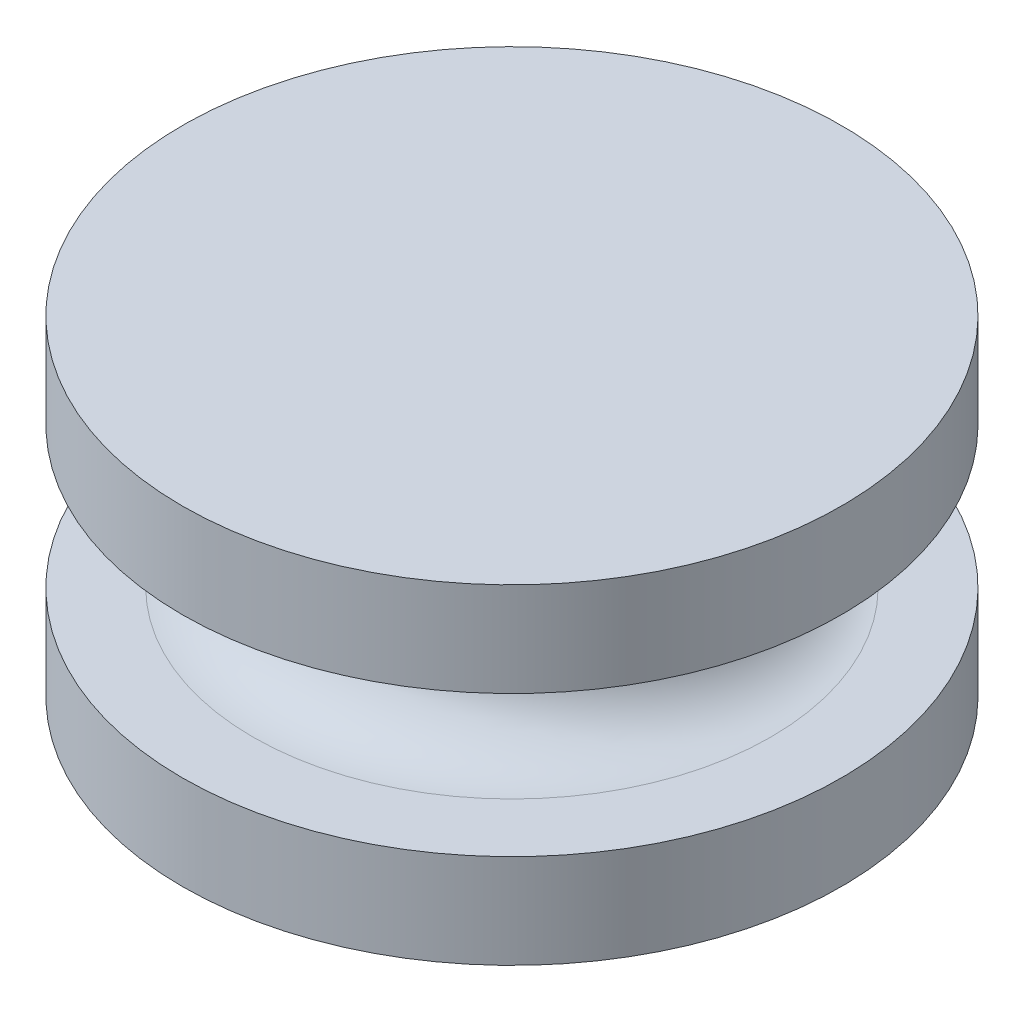
from build123d import *


with BuildPart() as part:
    # ｽｹｯﾁ1 → 回転1 (revolve)
    with BuildSketch(Plane.XY, mode=Mode.PRIVATE) as revolve_1_sk:
        with BuildLine():
            Line((0, 3.5), (-7, 3.5))
            Line((-7, 3.5), (-7, 1.5))
            Line((-7, 1.5), (-5.5, 1.5))
            ThreePointArc((-5.5, 1.5), (-4, 0), (-5.5, -1.5))
            Line((-5.5, -1.5), (-7, -1.5))
            Line((-7, -1.5), (-7, -3.5))
            Line((-7, -3.5), (0, -3.5))
            Line((0, -3.5), (0, 3.5))
        make_face()
    revolve(revolve_1_sk.sketch.rotate(Axis((0, 3.5, 0), (0, -1, 0)), 270), axis=Axis((0, 3.5, 0), (0, -1, 0)))


solid = part.part
